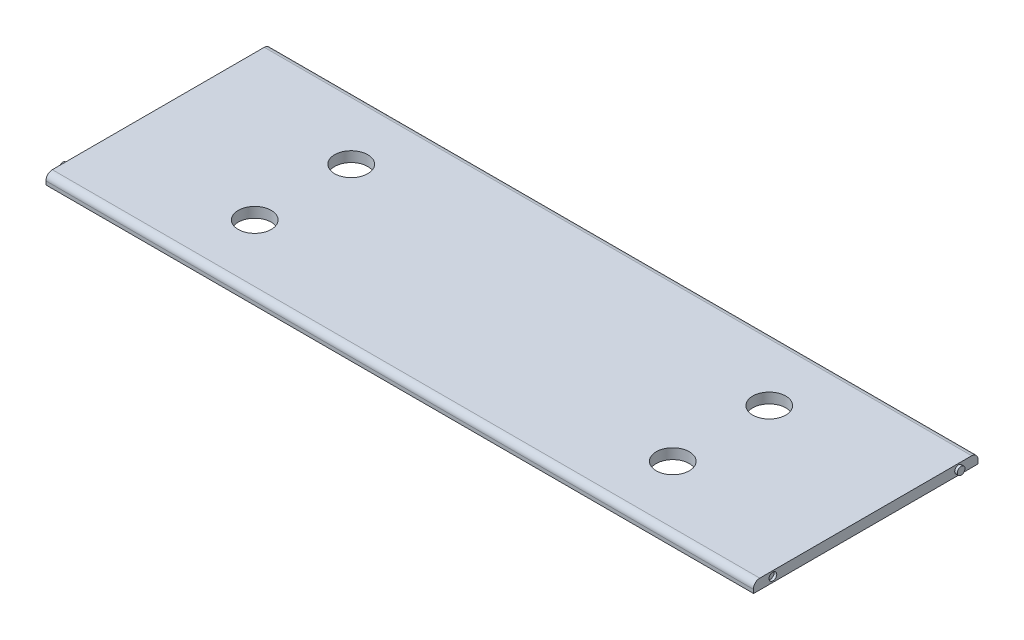
from build123d import *

# Parameters (mm, degrees)
BOSS_EXTRUDE1_DEPTH            = 22.225
CUT_EXTRUDE1_REACH             = 331.298
SKETCH2_R                      = 4.7625
CUT_EXTRUDE1_DIRECTION_2_REACH = 331.298
CUT_EXTRUDE2_DEPTH             = 254
FILLET1_R                      = 12.7
FILLET4_R                      = 1.2446
F_1_4_CLEARANCE_HOLE1_D        = 6.5278
F_1_4_CLEARANCE_HOLE1_DEPTH    = 6.35
F_1_4_CLEARANCE_HOLE1_TIP      = 1.961148974
SKETCH6_W                      = 65.609477097
SKETCH6_H                      = 246.187780251
CUT_EXTRUDE3_DEPTH             = 200.66
SKETCH7_W                      = 53.894876093
SKETCH7_H                      = 277.088175353
CUT_EXTRUDE4_DEPTH             = 200.66
SKETCH8_R                      = 0.762
BOSS_EXTRUDE2_DEPTH            = 0.508
SKETCH9_R                      = 0.762
CUT_EXTRUDE5_DEPTH             = 0.508
SKETCH10_R                     = 0.762
CUT_EXTRUDE6_DEPTH             = 0.508
SKETCH11_R                     = 0.762
BOSS_EXTRUDE3_DEPTH            = 0.508


with BuildPart() as part:
    # Sketch1 → Boss-Extrude1 (new, symmetric)
    with BuildSketch(Plane.XY):
        with BuildLine():
            add(Edge.make_bspline(
                [(247.65, 12.7), (247.65, 151.138652105), (159.851901214, 215.9), (69.85, 215.9)],
                knots=[0, 0, 0, 0, 1, 1, 1, 1], degree=3))
            Line((69.85, 215.9), (-69.85, 215.9))
            add(Edge.make_bspline(
                [(-69.85, 215.9), (-159.851901214, 215.9), (-247.65, 151.138652105), (-247.65, 12.7)],
                knots=[0, 0, 0, 0, 1, 1, 1, 1], degree=3))
            Line((-247.65, 12.7), (-247.65, -12.7))
            Line((-247.65, -12.7), (-245.618, -12.7))
            Line((-245.618, -12.7), (-245.618, 12.7))
            add(Edge.make_bspline(
                [(-69.85, 213.868), (-75.40386678, 213.868), (-86.529134162, 213.367524052), (-108.503296863, 210.348405687), (-135.224023579, 202.760511588), (-165.078062417, 187.457160851), (-187.304904565, 169.454437631), (-203.008125467, 151.842675097), (-213.624406237, 137.012147223), (-222.956422719, 120.542434531), (-230.879834274, 102.41559311), (-237.26896978, 82.613605898), (-241.209008074, 64.702111997), (-243.466672055, 49.517673174), (-244.696729955, 37.702743517), (-245.322441099, 27.489835839), (-245.575395866, 19.120958406), (-245.618, 14.831688899), (-245.618, 12.7)],
                knots=[0, 0, 0, 0, 0.0625, 0.125, 0.25, 0.375, 0.5, 0.5625, 0.625, 0.6875, 0.75, 0.8125, 0.875, 0.90625, 0.9375, 0.96875, 0.984375, 1, 1, 1, 1], degree=3))
            Line((-69.85, 213.868), (69.85, 213.868))
            add(Edge.make_bspline(
                [(245.618, 12.7), (245.618, 14.831688899), (245.575395866, 19.120958406), (245.322441099, 27.489835839), (244.696729955, 37.702743517), (243.466672055, 49.517673174), (241.209008074, 64.702111997), (237.26896978, 82.613605898), (230.879834274, 102.41559311), (222.956422719, 120.542434531), (213.624406237, 137.012147223), (203.008125467, 151.842675097), (187.304904565, 169.454437631), (165.078062417, 187.457160851), (135.224023579, 202.760511588), (108.503296863, 210.348405687), (86.529134162, 213.367524052), (75.40386678, 213.868), (69.85, 213.868)],
                knots=[0, 0, 0, 0, 0.015625, 0.03125, 0.0625, 0.09375, 0.125, 0.1875, 0.25, 0.3125, 0.375, 0.4375, 0.5, 0.625, 0.75, 0.875, 0.9375, 1, 1, 1, 1], degree=3))
            Line((245.618, 12.7), (245.618, -12.7))
            Line((245.618, -12.7), (247.65, -12.7))
            Line((247.65, -12.7), (247.65, 12.7))
        make_face()
    extrude(amount=BOSS_EXTRUDE1_DEPTH, both=True)

    # Sketch2 → Cut-Extrude1 (cut, up to next)
    with BuildSketch(Plane(origin=(0, 0, 0), x_dir=(0, 0, -1), z_dir=(1, 0, 0)), mode=Mode.PRIVATE) as cut_extrude1_sk1:
        Circle(SKETCH2_R)
    cut_extrude1_tool1 = extrude(cut_extrude1_sk1.sketch, amount=-CUT_EXTRUDE1_REACH, mode=Mode.PRIVATE) & part.part
    add(cut_extrude1_tool1.solids().sort_by_distance((0, 0, 0))[0], mode=Mode.SUBTRACT)

    # Sketch2 → Cut-Extrude1 direction 2 (cut, up to next)
    with BuildSketch(Plane(origin=(0, 0, 0), x_dir=(0, 0, -1), z_dir=(1, 0, 0)), mode=Mode.PRIVATE) as cut_extrude1_direction_2_sk1:
        Circle(SKETCH2_R)
    cut_extrude1_direction_2_tool1 = extrude(cut_extrude1_direction_2_sk1.sketch, amount=CUT_EXTRUDE1_DIRECTION_2_REACH, mode=Mode.PRIVATE) & part.part
    add(cut_extrude1_direction_2_tool1.solids().sort_by_distance((0, 0, 0))[0], mode=Mode.SUBTRACT)

    # Sketch3 → Cut-Extrude2 (cut, symmetric)
    with BuildSketch(Plane(origin=(0, 0, 0), x_dir=(0, 0, -1), z_dir=(1, 0, 0))):
        Polygon((-22.225, 215.9), (-12.7, -12.7), (-47.625, -12.7), (-47.625, 215.9), align=None)
        Polygon((22.225, 215.9), (12.7, -12.7), (47.625, -12.7), (47.625, 215.9), align=None)
    extrude(amount=CUT_EXTRUDE2_DEPTH, both=True, mode=Mode.SUBTRACT)

    # Fillet1
    fillet1_edges = [part.edges().sort_by_distance(p)[0] for p in [
        (-246.634, -12.7, -12.7),
        (-246.634, -12.7, 12.7),
        (246.634, -12.7, -12.7),
        (246.634, -12.7, 12.7),
    ]]
    fillet(fillet1_edges, radius=FILLET1_R)

    # Fillet4
    fillet4_edges = [part.edges().sort_by_distance(p)[0] for p in [
        (247.65, -9.165276607, -9.309489742),
        (247.65, 6.085646041, -13.482735252),
        (-247.65, -9.165276607, -9.309489742),
        (-247.65, 6.085646041, -13.482735252),
        (247.65, -9.165276607, 9.309489742),
        (247.65, 6.085646041, 13.482735252),
        (-247.65, -9.165276607, 9.309489742),
        (-247.65, 6.085646041, 13.482735252),
        (0, 215.9, 22.225),
        (-203.084938623, 154.469294773, 19.665387282),
        (-247.65, -12.7, 0),
        (-203.084938623, 154.469294773, -19.665387282),
        (0, 215.9, -22.225),
        (203.084938625, 154.469294774, -19.665387282),
        (247.65, -12.7, 0),
        (203.084938625, 154.469294774, 19.665387282),
    ]]
    fillet(fillet4_edges, radius=FILLET4_R)

    # 1/4 Clearance Hole1
    with Locations(Plane(origin=(5.734151724, 215.9, -6.658847299), x_dir=(1, 0, 0), z_dir=(0, 1, 0))):
        with Locations((35.540848276, -16.183847299), (35.540848276, 2.866152701), (-47.009151724, -16.183847299), (-47.009151724, 2.866152701)):
            Hole(F_1_4_CLEARANCE_HOLE1_D / 2, depth=F_1_4_CLEARANCE_HOLE1_DEPTH)
            with Locations((0, 0, -(F_1_4_CLEARANCE_HOLE1_DEPTH + F_1_4_CLEARANCE_HOLE1_TIP / 2))):  # 118° drill point
                Cone(0, F_1_4_CLEARANCE_HOLE1_D / 2, F_1_4_CLEARANCE_HOLE1_TIP, mode=Mode.SUBTRACT)

    # Sketch6 → Cut-Extrude3 (cut)
    with BuildSketch(Plane.ZY.offset(-69.85)):
        with Locations((-2.573891908, 99.039872329)):
            Rectangle(SKETCH6_W, SKETCH6_H)
    extrude(amount=-CUT_EXTRUDE3_DEPTH, mode=Mode.SUBTRACT)

    # Sketch7 → Cut-Extrude4 (cut)
    with BuildSketch(Plane.ZY.offset(69.85)):
        with Locations((-0.531372719, 92.342266691)):
            Rectangle(SKETCH7_W, SKETCH7_H)
    extrude(amount=CUT_EXTRUDE4_DEPTH, mode=Mode.SUBTRACT)

    # Sketch8 → Boss-Extrude2 (add)
    with BuildSketch(Plane(origin=(69.85, 0, 0), x_dir=(0, 0, -1), z_dir=(1, 0, 0))):
        with Locations((18.330333333, 214.884)):
            Circle(SKETCH8_R)
    extrude(amount=BOSS_EXTRUDE2_DEPTH)

    # Sketch9 → Cut-Extrude5 (cut)
    with BuildSketch(Plane(origin=(69.85, 0, 0), x_dir=(0, 0, -1), z_dir=(1, 0, 0))):
        with Locations((-18.330333333, 214.884)):
            Circle(SKETCH9_R)
    extrude(amount=-CUT_EXTRUDE5_DEPTH, mode=Mode.SUBTRACT)

    # Sketch10 → Cut-Extrude6 (cut)
    with BuildSketch(Plane.ZY.offset(69.85)):
        with Locations((-18.330333333, 214.884)):
            Circle(SKETCH10_R)
    extrude(amount=-CUT_EXTRUDE6_DEPTH, mode=Mode.SUBTRACT)

    # Sketch11 → Boss-Extrude3 (add)
    with BuildSketch(Plane.ZY.offset(69.85)):
        with Locations((18.330333333, 214.884)):
            Circle(SKETCH11_R)
    extrude(amount=BOSS_EXTRUDE3_DEPTH)


solid = part.part
